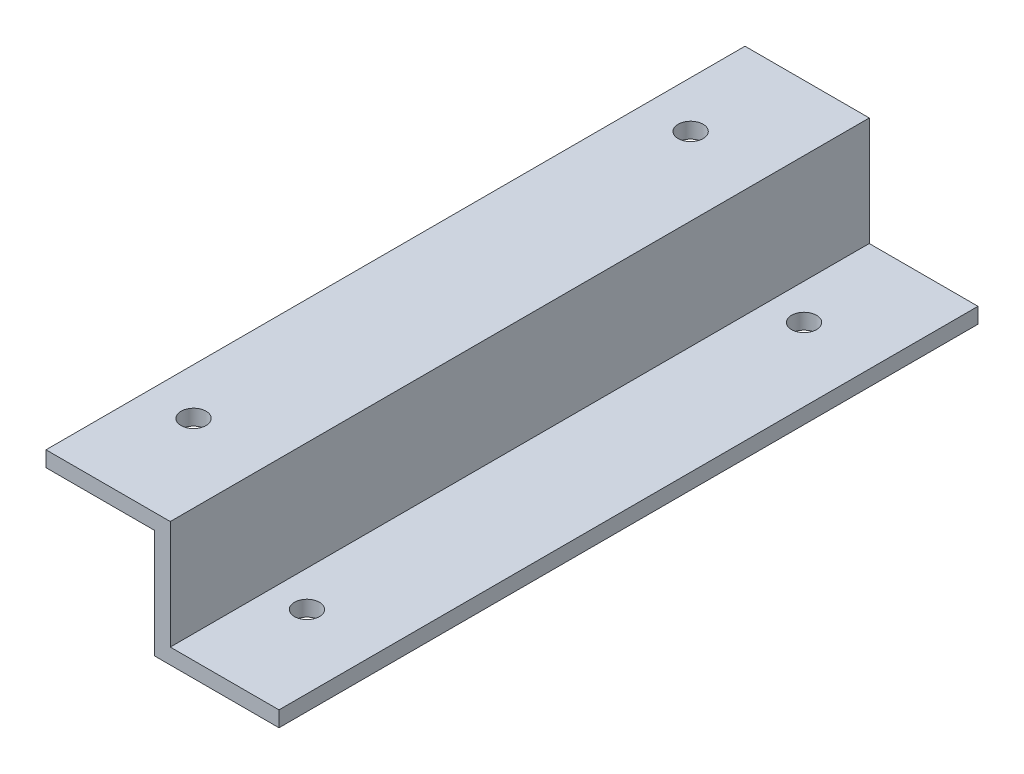
from build123d import *

# Parameters (mm, degrees)
BOSS_EXTRUDE1_DEPTH      = 71.4375
BOSS_EXTRUDE1_DEPTH_BACK = 71.4375
F_10_CLEARANCE_HOLE1_D   = 5.1054
F_10_CLEARANCE_HOLE2_D   = 5.1054


with BuildPart() as part:
    # Sketch3 → Boss-Extrude1 (new, two sides: drawn at the far end of the back side and taken through both)
    with BuildSketch(Plane.XY.offset(-BOSS_EXTRUDE1_DEPTH_BACK)):
        Polygon((23.8125, -9.525), (23.8125, -12.7), (-1.5875, -12.7), (-1.5875, 9.525), (-23.8125, 9.525), (-23.8125, 12.7), (1.5875, 12.7), (1.5875, -9.525), align=None)
    extrude(amount=BOSS_EXTRUDE1_DEPTH + BOSS_EXTRUDE1_DEPTH_BACK)

    # #10 Clearance Hole1 (through all)
    with Locations(Plane(origin=(0, 12.7, 0), x_dir=(1, 0, 0), z_dir=(0, 1, 0))):
        with Locations((-14.2875, -50.800000508), (-14.2875, 50.799999492)):
            Hole(F_10_CLEARANCE_HOLE1_D / 2)

    # #10 Clearance Hole2 (through all)
    with Locations(Plane(origin=(0, -9.525, 0), x_dir=(1, 0, 0), z_dir=(0, 1, 0))):
        with Locations((8.89, -50.800000508), (8.89, 50.799700006)):
            Hole(F_10_CLEARANCE_HOLE2_D / 2)


solid = part.part
